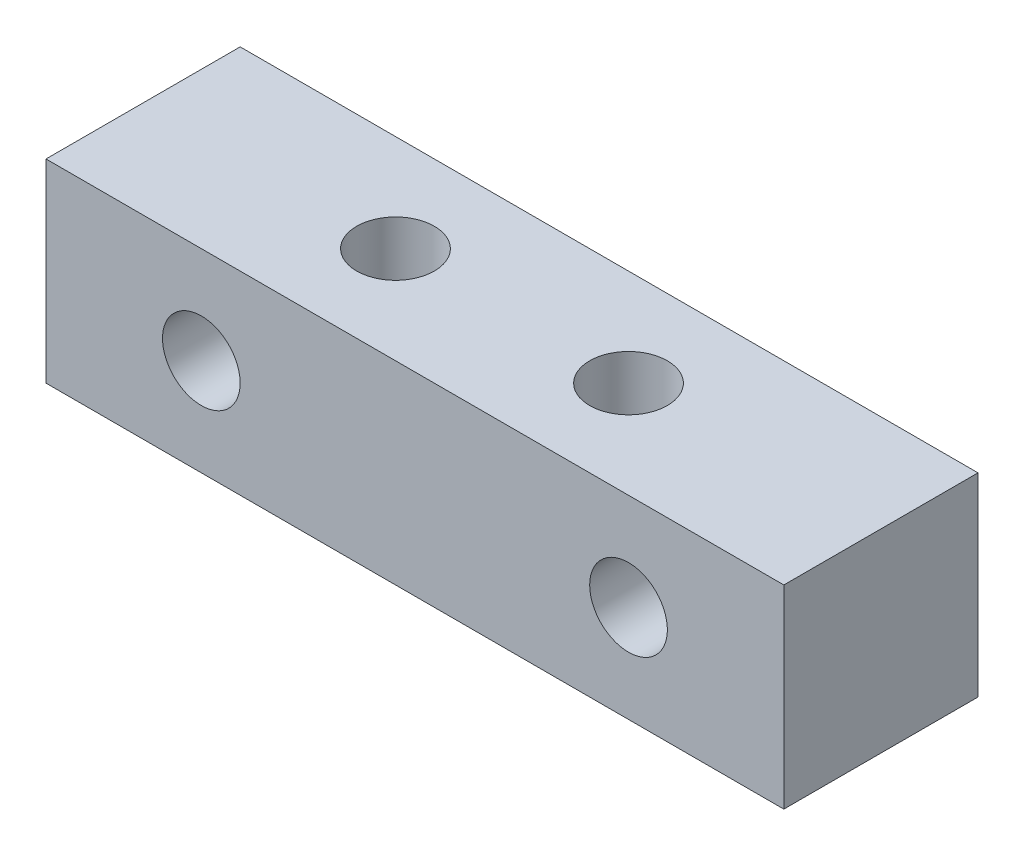
from build123d import *

# Parameters (mm, degrees)
SKETCH_1_W          = 38
SKETCH_1_H          = 10
EXTRUDE_1_DEPTH     = 10
SKETCH_3_R          = 2
CUT_EXTRUDE_1_DEPTH = 10
SKETCH_4_R          = 2
CUT_EXTRUDE_2_DEPTH = 10


with BuildPart() as part:
    # 草图1 → 凸台-拉伸1 (new body)
    with BuildSketch(Plane.XY):
        Rectangle(SKETCH_1_W, SKETCH_1_H)
    extrude(amount=EXTRUDE_1_DEPTH)

    # 草图3 → 切除-拉伸1 (cut)
    with BuildSketch(Plane.XY.offset(10)):
        with Locations((-11, 0)):
            Circle(SKETCH_3_R)
        with Locations(Location((11, 0, 0), (0, 0, 180))):
            Circle(SKETCH_3_R)
    extrude(amount=-CUT_EXTRUDE_1_DEPTH, mode=Mode.SUBTRACT)

    # 草图4 → 切除-拉伸2 (cut)
    with BuildSketch(Plane(origin=(0, 5, 0), x_dir=(1, 0, 0), z_dir=(0, 1, 0))):
        with Locations(Location((-6, -5, 0), (0, 0, 270))):
            Circle(SKETCH_4_R)
        with Locations(Location((6, -5, 0), (0, 0, 90))):
            Circle(SKETCH_4_R)
    extrude(amount=-CUT_EXTRUDE_2_DEPTH, mode=Mode.SUBTRACT)


solid = part.part
